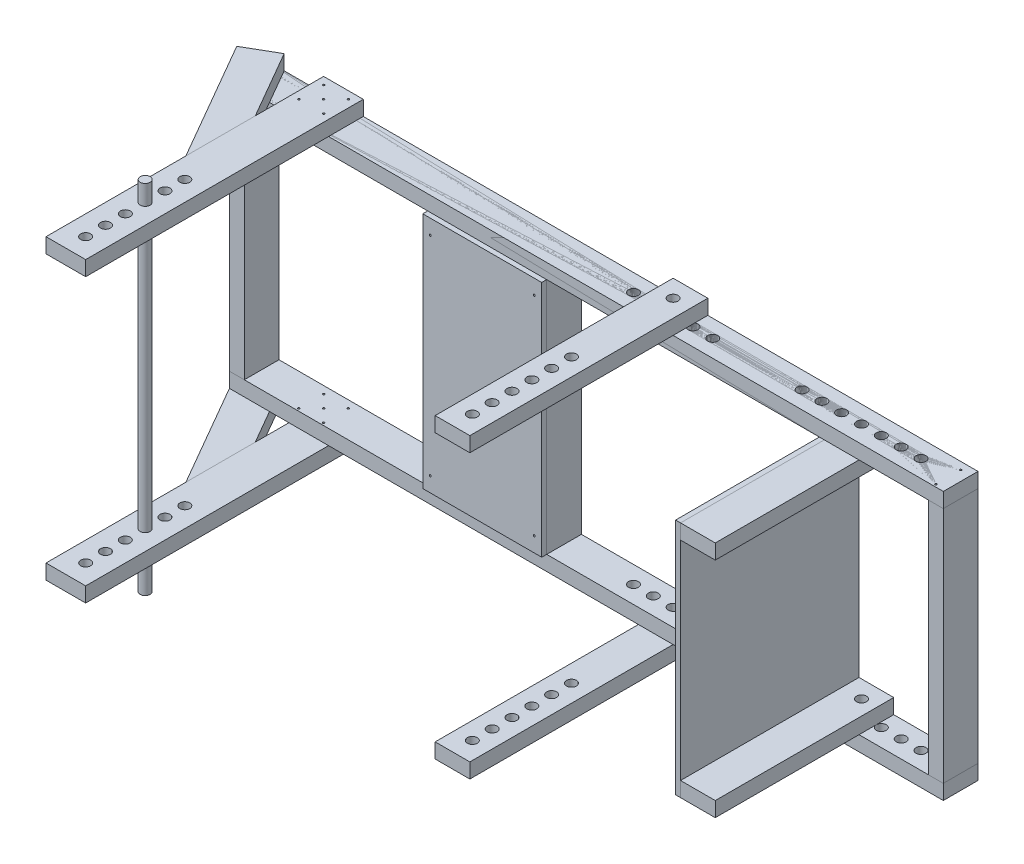
from build123d import *

# Parameters (mm, degrees)
SKETCH1_W               = 1828.8
SKETCH1_H               = 38.1
BOSS_EXTRUDE1_DEPTH     = 88.9
SKETCH2_W               = 38.1
SKETCH2_H               = 88.9
BOSS_EXTRUDE2_DEPTH     = 609.6
BOSS_EXTRUDE2_2_DEPTH   = 609.6
BOSS_EXTRUDE2_3_DEPTH   = 609.6
BOSS_EXTRUDE2_4_DEPTH   = 609.6
SKETCH3_W               = 1828.8
SKETCH3_H               = 38.1
BOSS_EXTRUDE3_DEPTH     = 88.9
CUT_EXTRUDE3_START      = -685.8
SKETCH14_R              = 12.7
CUT_EXTRUDE3_DEPTH      = 685.8
SKETCH4_W               = 101.6
SKETCH4_H               = 711.2
SKETCH4_R               = 12.7
BOSS_EXTRUDE4_DEPTH     = 38.1
SKETCH4_W_2             = 88.9
SKETCH4_H_2             = 609.6
BOSS_EXTRUDE4_2_DEPTH   = 38.1
SKETCH5_W               = 88.9
SKETCH5_H               = 457.2
BOSS_EXTRUDE6_DEPTH     = 38.1
SKETCH6_R               = 2.413
CUT_EXTRUDE1_DEPTH      = 25.4
SKETCH7_W               = 457.2
SKETCH7_H               = 609.6
SKETCH7_R               = 2.413
BOSS_EXTRUDE7_DEPTH     = 12.7
SKETCH11_R              = 12.7
BOSS_EXTRUDE9_DEPTH     = 914.4
SKETCH12_W              = 304.8
SKETCH12_H              = 609.6
BOSS_EXTRUDE11_DEPTH    = 12.7
CUT_EXTRUDE4_START      = -762
SKETCH15_R              = 12.7
CUT_EXTRUDE4_DEPTH      = 762
SKETCH16_R              = 2.413
CUT_EXTRUDE7_DEPTH      = 152.4
CUT_EXTRUDE8_DEPTH      = 50.8
CUT_EXTRUDE8_DEPTH_BACK = 50.8
SKETCH17_R              = 2.413
BOSS_EXTRUDE12_DEPTH    = 38.1


with BuildPart() as part:
    # Sketch1 → Boss-Extrude1 (new body)
    with BuildSketch(Plane.XY):
        with Locations((914.4, -19.05)):
            Rectangle(SKETCH1_W, SKETCH1_H)
    extrude(amount=-BOSS_EXTRUDE1_DEPTH)


with BuildPart() as body_2:
    # Sketch2 → Boss-Extrude2 (new body)
    with BuildSketch(Plane(origin=(0, 0, 0), x_dir=(1, 0, 0), z_dir=(0, 1, 0))):
        with Locations((1809.75, 44.45)):
            Rectangle(SKETCH2_W, SKETCH2_H)
    extrude(amount=BOSS_EXTRUDE2_DEPTH)


with BuildPart() as body_3:
    # Sketch2 → Boss-Extrude2 2 (new body)
    with BuildSketch(Plane(origin=(0, 0, 0), x_dir=(1, 0, 0), z_dir=(0, 1, 0))):
        with Locations((19.05, 44.45)):
            Rectangle(SKETCH2_W, SKETCH2_H)
    extrude(amount=BOSS_EXTRUDE2_2_DEPTH)


with BuildPart() as body_4:
    # Sketch2 → Boss-Extrude2 3 (new body)
    with BuildSketch(Plane(origin=(0, 0, 0), x_dir=(1, 0, 0), z_dir=(0, 1, 0))):
        with Locations((527.05, 44.45)):
            Rectangle(SKETCH2_W, SKETCH2_H)
    extrude(amount=BOSS_EXTRUDE2_3_DEPTH)


with BuildPart() as body_5:
    # Sketch2 → Boss-Extrude2 4 (new body)
    with BuildSketch(Plane(origin=(0, 0, 0), x_dir=(1, 0, 0), z_dir=(0, 1, 0))):
        with Locations((793.75, 44.45)):
            Rectangle(SKETCH2_W, SKETCH2_H)
    extrude(amount=BOSS_EXTRUDE2_4_DEPTH)


with BuildPart() as body_6:
    # Sketch3 → Boss-Extrude3 (new body)
    with BuildSketch(Plane.XY):
        with Locations((914.4, 628.65)):
            Rectangle(SKETCH3_W, SKETCH3_H)
    extrude(amount=-BOSS_EXTRUDE3_DEPTH)


with BuildPart() as cut_extrude3_tool:
    # Sketch14 → Cut-Extrude3 (new body)
    with BuildSketch(Plane(origin=(0, 647.7, 0), x_dir=(1, 0, 0), z_dir=(0, 1, 0)).offset(CUT_EXTRUDE3_START)):
        with Locations(Location((1676.4, 44.45, 0), (0, 0, 180))):
            Circle(SKETCH14_R)
        with Locations(Location((1625.6, 44.45, 0), (0, 0, 180))):
            Circle(SKETCH14_R)
        with Locations(Location((1574.8, 44.45, 0), (0, 0, 180))):
            Circle(SKETCH14_R)
        with Locations(Location((1524, 44.45, 0), (0, 0, 180))):
            Circle(SKETCH14_R)
        with Locations(Location((1473.2, 44.45, 0), (0, 0, 180))):
            Circle(SKETCH14_R)
        with Locations(Location((1193.8, 44.45, 0), (0, 0, 180))):
            Circle(SKETCH14_R)
        with Locations(Location((1143, 44.45, 0), (0, 0, 180))):
            Circle(SKETCH14_R)
        with Locations(Location((1092.2, 44.45, 0), (0, 0, 180))):
            Circle(SKETCH14_R)
        with Locations(Location((1041.4, 44.45, 0), (0, 0, 180))):
            Circle(SKETCH14_R)
        with Locations(Location((990.6, 44.45, 0), (0, 0, 180))):
            Circle(SKETCH14_R)
        with Locations(Location((1422.4, 44.45, 0), (0, 0, 180))):
            Circle(SKETCH14_R)
        with Locations(Location((1727.2, 44.45, 0), (0, 0, 180))):
            Circle(SKETCH14_R)
    extrude(amount=CUT_EXTRUDE3_DEPTH)


with BuildPart() as part_1:
    add(part.part)

    # Cut-Extrude3: cut by cut_extrude3_tool
    add(cut_extrude3_tool.part, mode=Mode.SUBTRACT)

    # Sketch5 → Boss-Extrude6 (add)
    with BuildSketch(Plane(origin=(0, 0, 0), x_dir=(1, 0, 0), z_dir=(0, 1, 0))):
        with Locations((1568.45, -139.7)):
            Rectangle(SKETCH5_W, SKETCH5_H)
    extrude(amount=BOSS_EXTRUDE6_DEPTH)

    # Sketch6 → Cut-Extrude1 (cut)
    with BuildSketch(Plane.ZY.offset(-1524)):
        with Locations((330.2, 19.05)):
            Circle(SKETCH6_R)
        with Locations((139.7, 19.05)):
            Circle(SKETCH6_R)
        with Locations((-50.8, 19.05)):
            Circle(SKETCH6_R)
    extrude(amount=-CUT_EXTRUDE1_DEPTH, mode=Mode.SUBTRACT)


with BuildPart() as body_6_1:
    add(body_6.part)

    # Cut-Extrude3: cut by cut_extrude3_tool
    add(cut_extrude3_tool.part, mode=Mode.SUBTRACT)


with BuildPart() as body_7:
    # Sketch4 → Boss-Extrude4 (new body)
    with BuildSketch(Plane(origin=(0, 647.7, 0), x_dir=(1, 0, 0), z_dir=(0, 1, 0))):
        with Locations((203.2, -266.7)):
            Rectangle(SKETCH4_W, SKETCH4_H)
        with Locations((203.2, -571.5)):
            Circle(SKETCH4_R, mode=Mode.SUBTRACT)
        with Locations((203.2, -520.7)):
            Circle(SKETCH4_R, mode=Mode.SUBTRACT)
        with Locations((203.2, -469.9)):
            Circle(SKETCH4_R, mode=Mode.SUBTRACT)
        with Locations((203.2, -419.1)):
            Circle(SKETCH4_R, mode=Mode.SUBTRACT)
        with Locations((203.2, -368.3)):
            Circle(SKETCH4_R, mode=Mode.SUBTRACT)
        with Locations((203.2, -317.5)):
            Circle(SKETCH4_R, mode=Mode.SUBTRACT)
    extrude(amount=BOSS_EXTRUDE4_DEPTH)


with BuildPart() as body_8:
    # Sketch4 → Boss-Extrude4 2 (new body)
    with BuildSketch(Plane(origin=(0, 647.7, 0), x_dir=(1, 0, 0), z_dir=(0, 1, 0))):
        with Locations((1092.2, -215.9)):
            Rectangle(SKETCH4_W_2, SKETCH4_H_2)
        with Locations((1092.2, -469.9)):
            Circle(SKETCH4_R, mode=Mode.SUBTRACT)
        with Locations((1092.2, -419.1)):
            Circle(SKETCH4_R, mode=Mode.SUBTRACT)
        with Locations((1092.2, -368.3)):
            Circle(SKETCH4_R, mode=Mode.SUBTRACT)
        with Locations((1092.2, -317.5)):
            Circle(SKETCH4_R, mode=Mode.SUBTRACT)
        with Locations((1092.2, -266.7)):
            Circle(SKETCH4_R, mode=Mode.SUBTRACT)
        with Locations((1092.2, -215.9)):
            Circle(SKETCH4_R, mode=Mode.SUBTRACT)
    extrude(amount=BOSS_EXTRUDE4_2_DEPTH)


with BuildPart() as body_9:
    # Mirror4: mirrored copy
    add(body_7.part.mirror(Plane.ZX.offset(304.8)))


with BuildPart() as body_10:
    # Mirror4 2: mirrored copy
    add(body_8.part.mirror(Plane.ZX.offset(304.8)))


with BuildPart() as body_11:
    # Mirror4 3: mirrored copy
    add(part_1.part.mirror(Plane.ZX.offset(304.8)))


with BuildPart() as body_12:
    # Sketch7 → Boss-Extrude7 (new body)
    with BuildSketch(Plane.ZY.offset(-1524)):
        with Locations((139.7, 304.8)):
            Rectangle(SKETCH7_W, SKETCH7_H)
        with Locations((330.2, 590.55)):
            Circle(SKETCH7_R, mode=Mode.SUBTRACT)
        with Locations((139.7, 590.55)):
            Circle(SKETCH7_R, mode=Mode.SUBTRACT)
        with Locations((330.2, 19.05)):
            Circle(SKETCH7_R, mode=Mode.SUBTRACT)
        with Locations((139.7, 19.05)):
            Circle(SKETCH7_R, mode=Mode.SUBTRACT)
        with Locations((-50.8, 19.05)):
            Circle(SKETCH7_R, mode=Mode.SUBTRACT)
    extrude(amount=BOSS_EXTRUDE7_DEPTH)


with BuildPart() as body_13:
    # Sketch11 → Boss-Extrude9 (new body)
    with BuildSketch(Plane(origin=(0, 736.6, 0), x_dir=(1, 0, 0), z_dir=(0, 1, 0))):
        with Locations(Location((203.2, -419.1, 0), (0, 0, 270))):
            Circle(SKETCH11_R)
    extrude(amount=-BOSS_EXTRUDE9_DEPTH)


with BuildPart() as body_14:
    # Sketch12 → Boss-Extrude11 (new body)
    with BuildSketch(Plane.XY):
        with Locations((660.4, 304.8)):
            Rectangle(SKETCH12_W, SKETCH12_H)
    extrude(amount=BOSS_EXTRUDE11_DEPTH)


with BuildPart() as cut_extrude4_tool:
    # Sketch15 → Cut-Extrude4 (new body)
    with BuildSketch(Plane(origin=(0, 685.8, 0), x_dir=(1, 0, 0), z_dir=(0, 1, 0)).offset(CUT_EXTRUDE4_START)):
        with Locations(Location((1574.8, 44.45, 0), (0, 0, 180))):
            Circle(SKETCH15_R)
        with Locations(Location((1092.2, 44.45, 0), (0, 0, 270))):
            Circle(SKETCH15_R)
    extrude(amount=CUT_EXTRUDE4_DEPTH)


with BuildPart() as part_2:
    add(part_1.part)

    # Cut-Extrude4: cut by cut_extrude4_tool
    add(cut_extrude4_tool.part, mode=Mode.SUBTRACT)


with BuildPart() as body_8_1:
    add(body_8.part)

    # Cut-Extrude4: cut by cut_extrude4_tool
    add(cut_extrude4_tool.part, mode=Mode.SUBTRACT)


with BuildPart() as body_10_1:
    add(body_10.part)

    # Cut-Extrude4: cut by cut_extrude4_tool
    add(cut_extrude4_tool.part, mode=Mode.SUBTRACT)


with BuildPart() as body_11_1:
    add(body_11.part)

    # Cut-Extrude4: cut by cut_extrude4_tool
    add(cut_extrude4_tool.part, mode=Mode.SUBTRACT)


with BuildPart() as cut_extrude7_tool:
    # Sketch16 → Cut-Extrude7 (new body)
    with BuildSketch(Plane(origin=(0, 685.8, 0), x_dir=(1, 0, 0), z_dir=(0, 1, 0))):
        with Locations(Location((234.95, 6.35, 0), (0, 0, 270))):
            Circle(SKETCH16_R)
        with Locations(Location((171.45, 6.35, 0), (0, 0, 270))):
            Circle(SKETCH16_R)
        with Locations(Location((234.95, 69.85, 0), (0, 0, 270))):
            Circle(SKETCH16_R)
        with Locations(Location((171.45, 69.85, 0), (0, 0, 270))):
            Circle(SKETCH16_R)
        with Locations(Location((203.2, 38.1, 0), (0, 0, 270))):
            Circle(SKETCH16_R)
        with Locations(Location((25.4, 6.35, 0), (0, 0, 270))):
            Circle(SKETCH16_R)
        with Locations(Location((25.4, 69.85, 0), (0, 0, 270))):
            Circle(SKETCH16_R)
        with Locations(Location((1803.4, 6.35, 0), (0, 0, 270))):
            Circle(SKETCH16_R)
        with Locations(Location((1803.4, 69.85, 0), (0, 0, 270))):
            Circle(SKETCH16_R)
    cut_extrude7 = extrude(amount=-CUT_EXTRUDE7_DEPTH)


with BuildPart() as body_2_1:
    add(body_2.part)

    # Cut-Extrude7: cut by cut_extrude7_tool
    add(cut_extrude7_tool.part, mode=Mode.SUBTRACT)


with BuildPart() as body_3_1:
    add(body_3.part)

    # Cut-Extrude7: cut by cut_extrude7_tool
    add(cut_extrude7_tool.part, mode=Mode.SUBTRACT)


with BuildPart() as body_6_2:
    add(body_6_1.part)

    # Cut-Extrude7: cut by cut_extrude7_tool
    add(cut_extrude7_tool.part, mode=Mode.SUBTRACT)


with BuildPart() as body_7_1:
    add(body_7.part)

    # Cut-Extrude7: cut by cut_extrude7_tool
    add(cut_extrude7_tool.part, mode=Mode.SUBTRACT)


with BuildPart() as body_11_2:
    add(body_11_1.part)

    # Cut-Extrude7: cut by cut_extrude7_tool
    add(cut_extrude7_tool.part, mode=Mode.SUBTRACT)


with BuildPart() as mirror5_tool:
    # Mirror5: Cut-Extrude7 across plane
    add(cut_extrude7.mirror(Plane.ZX.offset(304.8)))


with BuildPart() as part_3:
    add(part_2.part)

    # Mirror5: cut by mirror5_tool
    add(mirror5_tool.part, mode=Mode.SUBTRACT)


with BuildPart() as body_2_2:
    add(body_2_1.part)

    # Mirror5: cut by mirror5_tool
    add(mirror5_tool.part, mode=Mode.SUBTRACT)


with BuildPart() as body_3_2:
    add(body_3_1.part)

    # Mirror5: cut by mirror5_tool
    add(mirror5_tool.part, mode=Mode.SUBTRACT)


with BuildPart() as body_9_1:
    add(body_9.part)

    # Mirror5: cut by mirror5_tool
    add(mirror5_tool.part, mode=Mode.SUBTRACT)


with BuildPart() as cut_extrude8_tool:
    # Sketch17 → Cut-Extrude8 (new, two sides: drawn at the far end of the back side and taken through both)
    with BuildSketch(Plane.XY.offset(12.7).offset(-CUT_EXTRUDE8_DEPTH_BACK)):
        with Locations((793.75, 38.1)):
            Circle(SKETCH17_R)
        with Locations((527.05, 38.1)):
            Circle(SKETCH17_R)
        with Locations((793.75, 571.5)):
            Circle(SKETCH17_R)
        with Locations((527.05, 571.5)):
            Circle(SKETCH17_R)
    extrude(amount=CUT_EXTRUDE8_DEPTH + CUT_EXTRUDE8_DEPTH_BACK)


with BuildPart() as body_4_1:
    add(body_4.part)

    # Cut-Extrude8: cut by cut_extrude8_tool
    add(cut_extrude8_tool.part, mode=Mode.SUBTRACT)


with BuildPart() as body_5_1:
    add(body_5.part)

    # Cut-Extrude8: cut by cut_extrude8_tool
    add(cut_extrude8_tool.part, mode=Mode.SUBTRACT)


with BuildPart() as body_14_1:
    add(body_14.part)

    # Cut-Extrude8: cut by cut_extrude8_tool
    add(cut_extrude8_tool.part, mode=Mode.SUBTRACT)


with BuildPart() as body_15:
    # Sketch18 → Boss-Extrude12 (new body)
    with BuildSketch(Plane(origin=(0, 685.8, 0), x_dir=(1, 0, 0), z_dir=(0, 1, 0))):
        Polygon((152.4, -263.964543073), (152.4, -86.164543073), (51.326438931, 88.9), (-25.663219465, 44.45), align=None)
    extrude(amount=-BOSS_EXTRUDE12_DEPTH)


with BuildPart() as body_16:
    # Mirror7: mirrored copy
    add(body_15.part.mirror(Plane.ZX.offset(304.8)))


solid = Compound([body_12.part, body_13.part, body_8_1.part, body_10_1.part, body_6_2.part, body_7_1.part, body_11_2.part, part_3.part, body_2_2.part, body_3_2.part, body_9_1.part, body_4_1.part, body_5_1.part, body_14_1.part, body_15.part, body_16.part])
